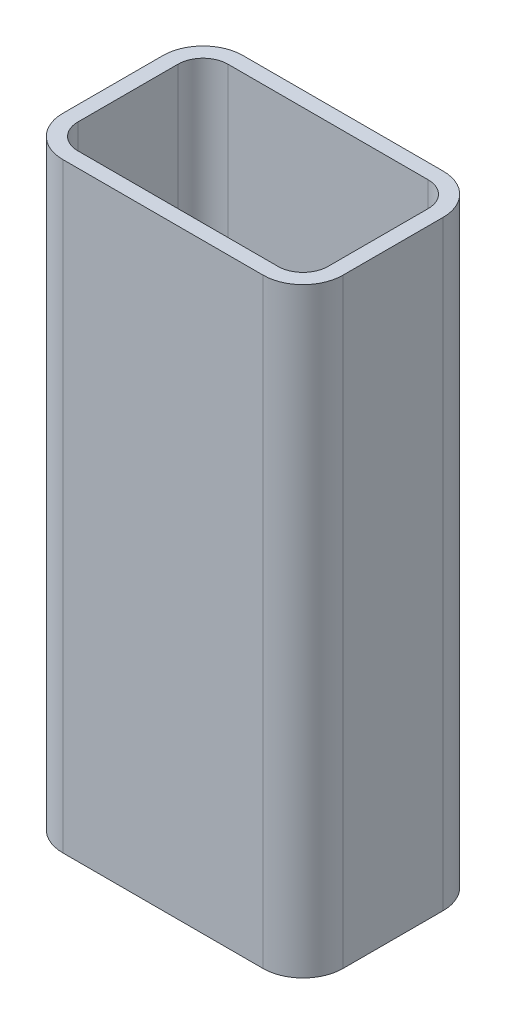
from build123d import *

# Parameters (mm, degrees)
EXTRUDE_THIN1_DEPTH = 60


with BuildPart() as part:
    # Sketch1 → Extrude-Thin1 (new, symmetric)
    with BuildSketch(Plane(origin=(0, 0, 0), x_dir=(1, 0, 0), z_dir=(0, 1, 0))):
        with BuildLine():
            Line((20, 18), (-20, 18))
            ThreePointArc((-20, 18), (-25.656854249, 15.656854249), (-28, 10))
            Line((-28, 10), (-28, -10))
            ThreePointArc((-28, -10), (-25.656854249, -15.656854249), (-20, -18))
            Line((-20, -18), (20, -18))
            ThreePointArc((20, -18), (25.656854249, -15.656854249), (28, -10))
            Line((28, -10), (28, 10))
            ThreePointArc((28, 10), (25.656854249, 15.656854249), (20, 18))
        make_face()
        with BuildLine():
            Line((20, 15), (-20, 15))
            ThreePointArc((-20, 15), (-23.535533906, 13.535533906), (-25, 10))
            Line((-25, 10), (-25, -10))
            ThreePointArc((-25, -10), (-23.535533906, -13.535533906), (-20, -15))
            Line((-20, -15), (20, -15))
            ThreePointArc((20, -15), (23.535533906, -13.535533906), (25, -10))
            Line((25, -10), (25, 10))
            ThreePointArc((25, 10), (23.535533906, 13.535533906), (20, 15))
        make_face(mode=Mode.SUBTRACT)
    extrude(amount=EXTRUDE_THIN1_DEPTH, both=True)


solid = part.part
